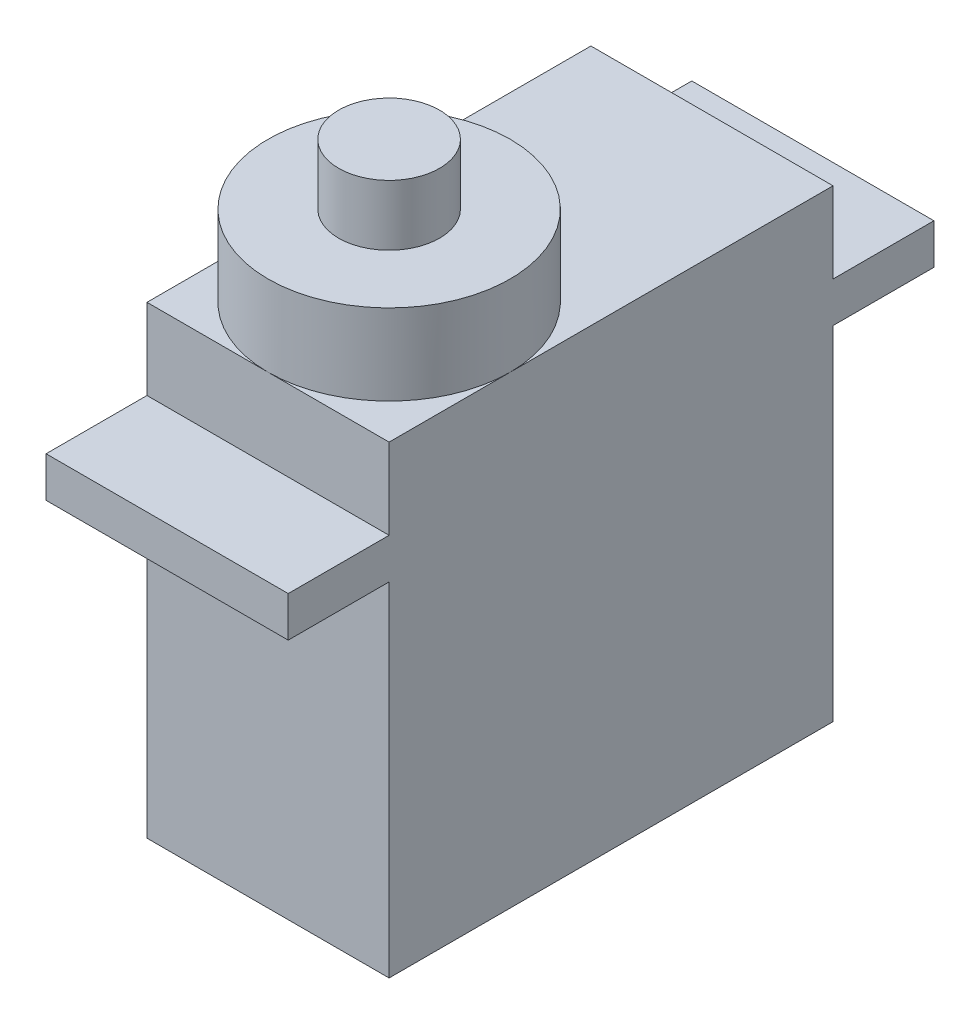
from build123d import *

# Parameters (mm, degrees)
SKETCH1_W           = 12
SKETCH1_H           = 22
BOSS_EXTRUDE1_DEPTH = 23
SKETCH3_W           = 12
SKETCH3_H           = 2
BOSS_EXTRUDE3_DEPTH = 5
SKETCH2_R           = 6
BOSS_EXTRUDE4_DEPTH = 4
SKETCH4_R           = 2.5
BOSS_EXTRUDE5_DEPTH = 3


with BuildPart() as part:
    # Sketch1 → Boss-Extrude1 (new body)
    with BuildSketch(Plane(origin=(0, 0, 0), x_dir=(1, 0, 0), z_dir=(0, 1, 0))):
        Rectangle(SKETCH1_W, SKETCH1_H)
    extrude(amount=BOSS_EXTRUDE1_DEPTH)

    # Sketch3 → Boss-Extrude3 (add)
    with BuildSketch(Plane(origin=(0, 0, -11), x_dir=(-1, 0, 0), z_dir=(0, 0, -1))):
        with Locations((0, 18)):
            Rectangle(SKETCH3_W, SKETCH3_H)
    boss_extrude3 = extrude(amount=BOSS_EXTRUDE3_DEPTH)

    # Mirror1: Boss-Extrude3 across plane
    add(boss_extrude3.mirror(Plane.XY))

    # Sketch2 → Boss-Extrude4 (add)
    with BuildSketch(Plane(origin=(0, 23, 0), x_dir=(1, 0, 0), z_dir=(0, 1, 0))):
        with Locations(Location((0, -5, 0), (0, 0, 270))):
            Circle(SKETCH2_R)
    extrude(amount=BOSS_EXTRUDE4_DEPTH)

    # Sketch4 → Boss-Extrude5 (add)
    with BuildSketch(Plane(origin=(0, 27, 0), x_dir=(1, 0, 0), z_dir=(0, 1, 0))):
        with Locations(Location((0, -5, 0), (0, 0, 270))):
            Circle(SKETCH4_R)
    extrude(amount=BOSS_EXTRUDE5_DEPTH)


solid = part.part
